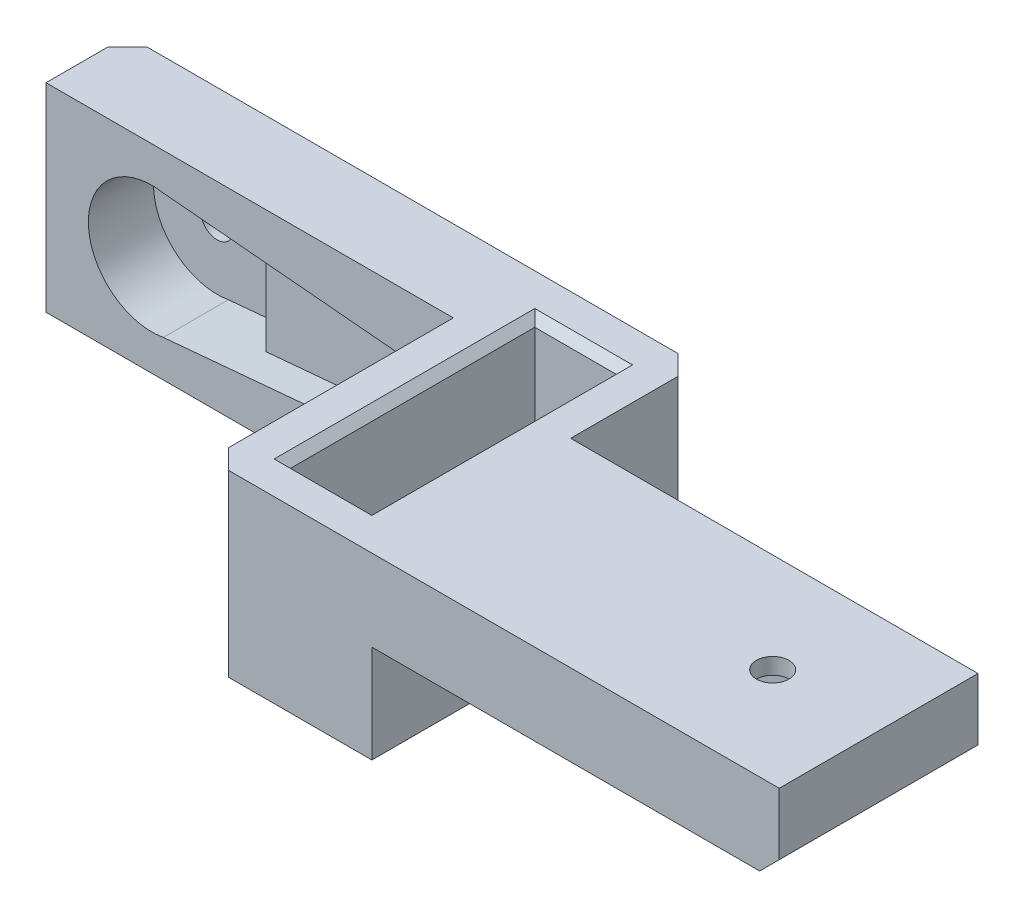
from build123d import *

# Parameters (mm, degrees)
SKETCH1_W               = 35
SKETCH1_H               = 12.2
BOSS_EXTRUDE1_DEPTH     = 5
SKETCH2_R               = 1
CUT_EXTRUDE1_DEPTH      = 38.775970389
SKETCH3_W               = 10
SKETCH3_H               = 12.2
BOSS_EXTRUDE2_DEPTH     = 15
SKETCH4_W               = 12.2
SKETCH4_H               = 5
BOSS_EXTRUDE3_DEPTH     = 25
CUT_EXTRUDE2_DEPTH      = 42.419255471
CUT_EXTRUDE2_DEPTH_BACK = 42.419255471
SKETCH5_R               = 1
CUT_EXTRUDE3_DEPTH      = 0.5
CHAMFER1_SIZE           = 1.2
SKETCH8_R               = 3.9
CUT_EXTRUDE4_DEPTH      = 4
CUT_EXTRUDE5_DEPTH      = 2
CUT_EXTRUDE6_DEPTH      = 4
SKETCH20_R              = 3.9
CUT_EXTRUDE11_DEPTH     = 4
CUT_EXTRUDE12_DEPTH     = 2
CUT_EXTRUDE13_DEPTH     = 4
SKETCH23_W              = 5
SKETCH23_H              = 15
CUT_EXTRUDE14_DEPTH     = 43.574108608
CHAMFER2_SIZE           = 0.5


with BuildPart() as part:
    # Sketch1 → Boss-Extrude1 (new body)
    with BuildSketch(Plane.XY):
        with Locations((-18.048765432, 5.660493827)):
            Rectangle(SKETCH1_W, SKETCH1_H)
    extrude(amount=BOSS_EXTRUDE1_DEPTH)

    # Sketch2 → Cut-Extrude1 (cut, through all)
    with BuildSketch(Plane.XY.offset(5)):
        with Locations((-29.048765432, 5.660493827)):
            Circle(SKETCH2_R)
    extrude(amount=-CUT_EXTRUDE1_DEPTH, mode=Mode.SUBTRACT)

    # Sketch3 → Boss-Extrude2 (add)
    with BuildSketch(Plane.XY.offset(5)):
        with Locations((-5.548765432, 5.660493827)):
            Rectangle(SKETCH3_W, SKETCH3_H)
    extrude(amount=BOSS_EXTRUDE2_DEPTH)

    # Sketch4 → Boss-Extrude3 (add)
    with BuildSketch(Plane(origin=(-0.548765432, 0, 0), x_dir=(0, 0, -1), z_dir=(1, 0, 0))):
        with Locations((-13.9, 9.260493827)):
            Rectangle(SKETCH4_W, SKETCH4_H)
    extrude(amount=BOSS_EXTRUDE3_DEPTH)

    # Sketch5 → Cut-Extrude2 (cut, two sides: drawn at the far end of the back side and taken through both)
    with BuildSketch(Plane.XZ.offset(-6.760493827).offset(-CUT_EXTRUDE2_DEPTH_BACK)):
        with Locations(Location((17.951234568, 13.9, 0), (0, 0, 270))):
            Circle(SKETCH5_R)
    extrude(amount=CUT_EXTRUDE2_DEPTH + CUT_EXTRUDE2_DEPTH_BACK, mode=Mode.SUBTRACT)

    # Sketch7 → Cut-Extrude3 (cut)
    with BuildSketch(Plane(origin=(0, 0, 0), x_dir=(-1, 0, 0), z_dir=(0, 0, -1))):
        Polygon((23.048765432, 5.660493827), (19.298765432, 7.825557337), (19.298765432, 3.495430318), align=None)
    extrude(amount=-CUT_EXTRUDE3_DEPTH, mode=Mode.SUBTRACT)

    # Chamfer1
    chamfer1_edges = [part.edges().sort_by_distance(p)[0] for p in [
        (-10.548765432, -0.439506173, 12.5),
        (-10.548765432, 5.660493827, 20),
        (-5.548765432, -0.439506173, 20),
        (24.451234568, 6.760493827, 13.9),
        (-0.548765432, 5.660493827, 0),
        (-18.048765432, -0.439506173, 0),
        (-35.548765432, 5.660493827, 0),
        (-0.548765432, -0.439506173, 10),
    ]]
    chamfer(chamfer1_edges, length=CHAMFER1_SIZE)

    # Sketch8 → Cut-Extrude4 (cut)
    with BuildSketch(Plane.XY.offset(5)):
        with Locations((-29.048765432, 5.660493827)):
            Circle(SKETCH8_R)
    extrude(amount=-CUT_EXTRUDE4_DEPTH, mode=Mode.SUBTRACT)

    # Sketch10 → Cut-Extrude5 (cut)
    with BuildSketch(Plane.XY.offset(5)):
        with BuildLine():
            Line((-29.048765432, 9.560493827), (-13.548765432, 8.160493827))
            ThreePointArc((-13.548765432, 8.160493827), (-11.048765432, 5.660493827), (-13.548765432, 3.160493827))
            Line((-13.548765432, 3.160493827), (-29.048765432, 1.760493827))
            Line((-29.048765432, 1.760493827), (-29.048765432, 9.560493827))
        make_face()
    extrude(amount=-CUT_EXTRUDE5_DEPTH, mode=Mode.SUBTRACT)

    # Sketch12 → Cut-Extrude6 (cut)
    with BuildSketch(Plane.XY.offset(5)):
        Polygon((-24.048765432, 5.660493827), (-24.048765432, 9.108880924), (-29.048765432, 9.560493827), (-29.048765432, 1.760493827), (-24.048765432, 2.21210673), align=None)
    extrude(amount=-CUT_EXTRUDE6_DEPTH, mode=Mode.SUBTRACT)

    # Sketch20 → Cut-Extrude11 (cut)
    with BuildSketch(Plane.XZ.offset(-6.760493827)):
        with Locations(Location((17.951234568, 13.9, 0), (0, 0, 270))):
            Circle(SKETCH20_R)
    extrude(amount=-CUT_EXTRUDE11_DEPTH, mode=Mode.SUBTRACT)

    # Sketch21 → Cut-Extrude12 (cut)
    with BuildSketch(Plane.XZ.offset(-6.760493827)):
        with BuildLine():
            Line((17.951234568, 17.8), (2.21295028, 16.4))
            ThreePointArc((2.21295028, 16.4), (-0.28704972, 13.9), (2.21295028, 11.4))
            Line((2.21295028, 11.4), (17.951234568, 10))
            Line((17.951234568, 10), (17.951234568, 17.8))
        make_face()
    extrude(amount=-CUT_EXTRUDE12_DEPTH, mode=Mode.SUBTRACT)

    # Sketch22 → Cut-Extrude13 (cut)
    with BuildSketch(Plane.XZ.offset(-6.760493827)):
        Polygon((17.951234568, 17.8), (17.951234568, 10), (12.951234568, 10.444775293), (12.951234568, 17.355224707), align=None)
    extrude(amount=-CUT_EXTRUDE13_DEPTH, mode=Mode.SUBTRACT)

    # Sketch23 → Cut-Extrude14 (cut, through all)
    with BuildSketch(Plane(origin=(0, 11.760493827, 0), x_dir=(1, 0, 0), z_dir=(0, 1, 0))):
        with Locations((-5.548765432, -10)):
            Rectangle(SKETCH23_W, SKETCH23_H)
    extrude(amount=-CUT_EXTRUDE14_DEPTH, mode=Mode.SUBTRACT)

    # Chamfer2
    chamfer2_edges = [part.edges().sort_by_distance(p)[0] for p in [
        (-8.048765432, -0.439506173, 10),
        (-5.548765432, -0.439506173, 2.5),
        (-3.048765432, -0.439506173, 10),
        (-5.548765432, -0.439506173, 17.5),
        (-8.048765432, 11.760493827, 10),
        (-5.548765432, 11.760493827, 17.5),
        (-3.048765432, 11.760493827, 10),
        (-5.548765432, 11.760493827, 2.5),
    ]]
    chamfer(chamfer2_edges, length=CHAMFER2_SIZE)


solid = part.part
